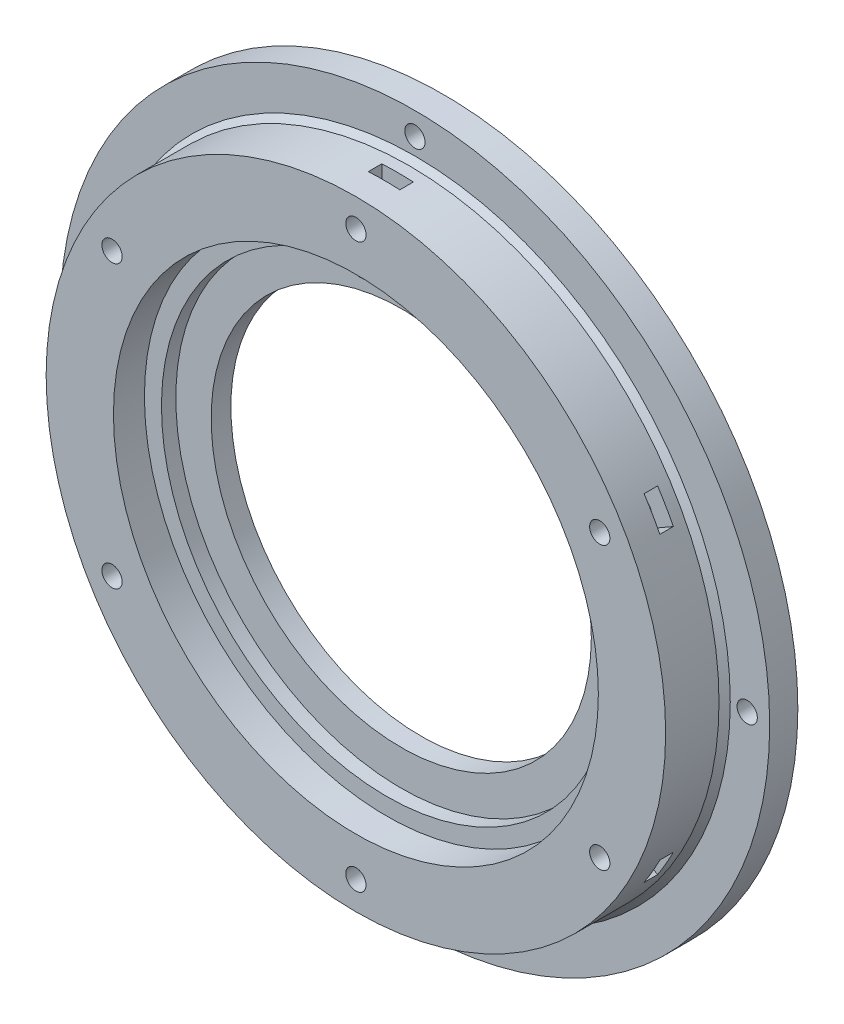
from build123d import *

# Parameters (mm, degrees)
SKETCH2_R               = 1.8
CUT_EXTRUDE1_DEPTH      = 10
SKETCH3_W               = 5.6
SKETCH3_H               = 10.691433847
CUT_EXTRUDE2_DEPTH      = 2.4
BOSS_EXTRUDE1_DEPTH     = 2.5
SKETCH5_R               = 1.8
CUT_EXTRUDE3_DEPTH      = 92.440311816
SKETCH6_W               = 5.6
SKETCH6_H               = 10.168713577
SKETCH6_W_2             = 10.168713577
SKETCH6_H_2             = 5.6
CUT_EXTRUDE4_DEPTH      = 2.4
CUT_EXTRUDE5_DEPTH      = 95.35095389
CUT_EXTRUDE5_DEPTH_BACK = 95.35095389
SKETCH7_W               = 158.937204397
SKETCH7_H               = 33.212886659
CHAMFER1_SIZE           = 1


with BuildPart() as part:
    # Sketch1 → Revolve1 (revolve)
    with BuildSketch(Plane(origin=(0, 0, 0), x_dir=(1, 0, 0), z_dir=(0, 1, 0))):
        Polygon((43.05, 0), (43.05, 5.5), (40.025, 5.5), (40.025, 8.05), (33.75, 8.05), (33.75, 11.55), (47.85, 11.55), (47.85, 26.05), (33.75, 26.05), (33.75, 31.05), (47.95, 31.05), (47.95, 29.05), (50.35, 29.05), (50.35, 24.05), (53.5, 24.05), (53.5, 31.05), (55, 31.05), (55, 20.475), (63, 20.475), (63, 10.475), (55, 10.475), (55, 0), align=None)
    revolve(axis=Axis((0, 0, 39.851832449), (0, 0, -1)))

    # Sketch2 → Cut-Extrude1 (cut)
    with BuildSketch(Plane.XY):
        with Locations((0, 50)):
            Circle(SKETCH2_R)
        with Locations((43.301270189, 25)):
            Circle(SKETCH2_R)
        with Locations((43.301270189, -25)):
            Circle(SKETCH2_R)
        with Locations((0, -50)):
            Circle(SKETCH2_R)
        with Locations((-43.301270189, -25)):
            Circle(SKETCH2_R)
        with Locations((-43.301270189, 25)):
            Circle(SKETCH2_R)
    extrude(amount=-CUT_EXTRUDE1_DEPTH, mode=Mode.SUBTRACT)

    # Sketch3 → Cut-Extrude2 (cut)
    with BuildSketch(Plane.XY.offset(-5)):
        with Locations((0, 52.545716924)):
            Rectangle(SKETCH3_W, SKETCH3_H)
        Polygon((51.535452373, 26.520845793), (48.735452373, 31.370588054), (39.476399059, 26.024871131), (42.276399059, 21.175128869), align=None)
        Polygon((48.735452373, -31.370588054), (51.535452373, -26.520845793), (42.276399059, -21.175128869), (39.476399059, -26.024871131), align=None)
        with Locations((0, -52.545716924)):
            Rectangle(SKETCH3_W, SKETCH3_H)
        Polygon((-51.535452373, -26.520845793), (-48.735452373, -31.370588054), (-39.476399059, -26.024871131), (-42.276399059, -21.175128869), align=None)
        Polygon((-48.735452373, 31.370588054), (-51.535452373, 26.520845793), (-42.276399059, 21.175128869), (-39.476399059, 26.024871131), align=None)
    extrude(amount=-CUT_EXTRUDE2_DEPTH, mode=Mode.SUBTRACT)

    # Sketch4 → Boss-Extrude1 (add)
    with BuildSketch(Plane.XY.offset(-5.5)):
        with BuildLine():
            Line((-2.45, 42.980228012), (-2.45, 39.949945244))
            ThreePointArc((-2.45, 39.949945244), (0, 40.025), (2.45, 39.949945244))
            Line((2.45, 39.949945244), (2.45, 42.980228012))
            ThreePointArc((2.45, 42.980228012), (0, 43.05), (-2.45, 42.980228012))
        make_face()
    extrude(amount=BOSS_EXTRUDE1_DEPTH)

    # Sketch5 → Cut-Extrude3 (cut, through all)
    with BuildSketch(Plane.XY.offset(-10.475)):
        with Locations((0, 59)):
            Circle(SKETCH5_R)
        with Locations((59, 0)):
            Circle(SKETCH5_R)
        with Locations((0, -59)):
            Circle(SKETCH5_R)
        with Locations((-59, 0)):
            Circle(SKETCH5_R)
    extrude(amount=-CUT_EXTRUDE3_DEPTH, mode=Mode.SUBTRACT)

    # Sketch6 → Cut-Extrude4 (cut)
    with BuildSketch(Plane.XY.offset(-16.775)):
        with Locations((0, 61.284356789)):
            Rectangle(SKETCH6_W, SKETCH6_H)
        with Locations((61.284356789, 0)):
            Rectangle(SKETCH6_W_2, SKETCH6_H_2)
        with Locations((0, -61.284356789)):
            Rectangle(SKETCH6_W, SKETCH6_H)
        with Locations((-61.284356789, 0)):
            Rectangle(SKETCH6_W_2, SKETCH6_H_2)
    extrude(amount=-CUT_EXTRUDE4_DEPTH, mode=Mode.SUBTRACT)

    # Sketch7 → Cut-Extrude5 (cut, two sides: drawn at the far end of the back side and taken through both)
    with BuildSketch(Plane(origin=(0, 0, 0), x_dir=(1, 0, 0), z_dir=(0, 1, 0)).offset(-CUT_EXTRUDE5_DEPTH_BACK)):
        with Locations((-3.919975894, 32.08144333)):
            Rectangle(SKETCH7_W, SKETCH7_H)
    extrude(amount=CUT_EXTRUDE5_DEPTH + CUT_EXTRUDE5_DEPTH_BACK, mode=Mode.SUBTRACT)

    # Chamfer1
    chamfer1_edges = [part.edges().sort_by_distance(p)[0] for p in [
        (-55, 0, -10.475),
    ]]
    chamfer(chamfer1_edges, length=CHAMFER1_SIZE)


solid = part.part
